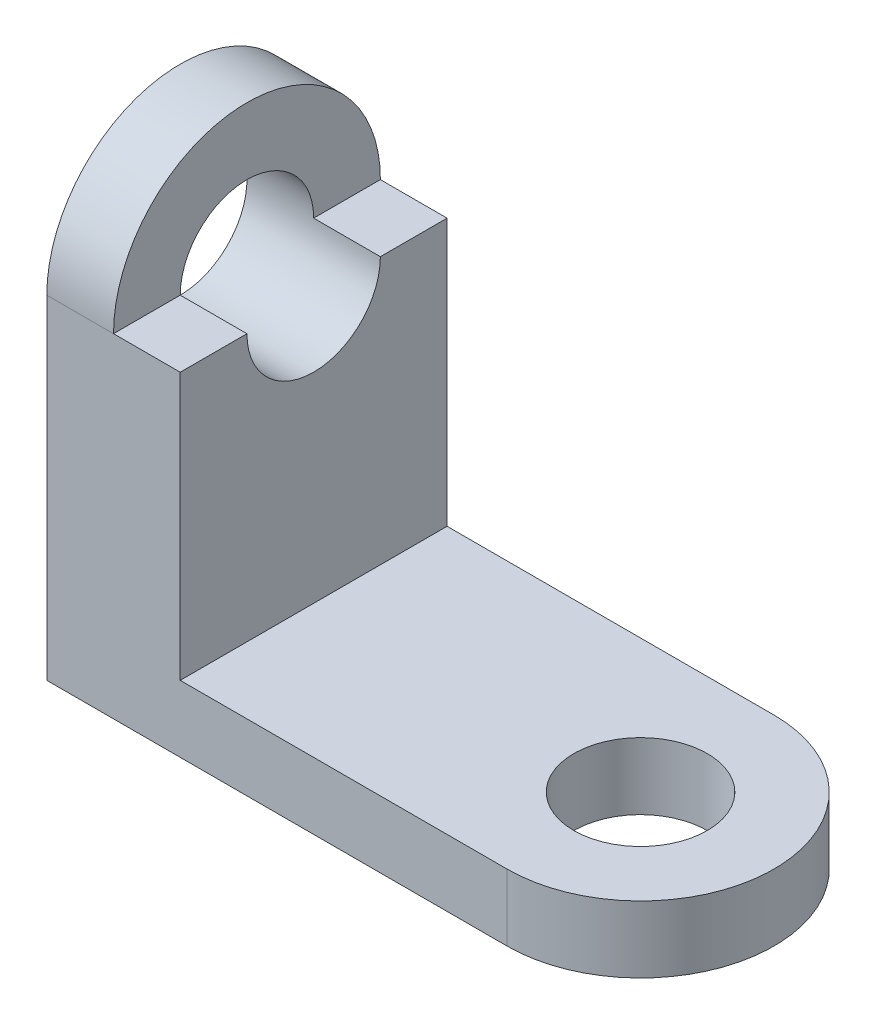
from build123d import *

# Parameters (mm, degrees)
SKETCH1_R           = 254
BOSS_EXTRUDE1_DEPTH = 254
SKETCH3_R           = 254
BOSS_EXTRUDE2_DEPTH = 254
BOSS_EXTRUDE3_DEPTH = 254


with BuildPart() as part:
    # Sketch1 → Boss-Extrude1 (new body)
    with BuildSketch(Plane(origin=(0, 0, 0), x_dir=(1, 0, 0), z_dir=(0, 1, 0))):
        with BuildLine():
            Line((0, 0), (0, 1016))
            Line((0, 1016), (1752.6, 1016))
            ThreePointArc((1752.6, 1016), (2260.6, 508), (1752.6, 0))
            Line((1752.6, 0), (0, 0))
        make_face()
        with Locations(Location((1752.6, 508, 0), (0, 0, 270))):
            Circle(SKETCH1_R, mode=Mode.SUBTRACT)
    extrude(amount=BOSS_EXTRUDE1_DEPTH)

    # Sketch3 → Boss-Extrude2 (add)
    with BuildSketch(Plane.ZY):
        with BuildLine():
            ThreePointArc((-1016, 1270), (-508, 1778), (0, 1270))
            Line((0, 1270), (0, 254))
            Line((0, 254), (-1016, 254))
            Line((-1016, 254), (-1016, 1270))
        make_face()
        with Locations((-508, 1270)):
            Circle(SKETCH3_R, mode=Mode.SUBTRACT)
    extrude(amount=-BOSS_EXTRUDE2_DEPTH)

    # Sketch4 → Boss-Extrude3 (add)
    with BuildSketch(Plane(origin=(254, 0, 0), x_dir=(0, 0, -1), z_dir=(1, 0, 0))):
        with BuildLine():
            Line((0, 1270), (254, 1270))
            ThreePointArc((254, 1270), (508, 1016), (762, 1270))
            Line((762, 1270), (1016, 1270))
            Line((1016, 1270), (1016, 254))
            Line((1016, 254), (0, 254))
            Line((0, 254), (0, 1270))
        make_face()
    extrude(amount=BOSS_EXTRUDE3_DEPTH)


solid = part.part
